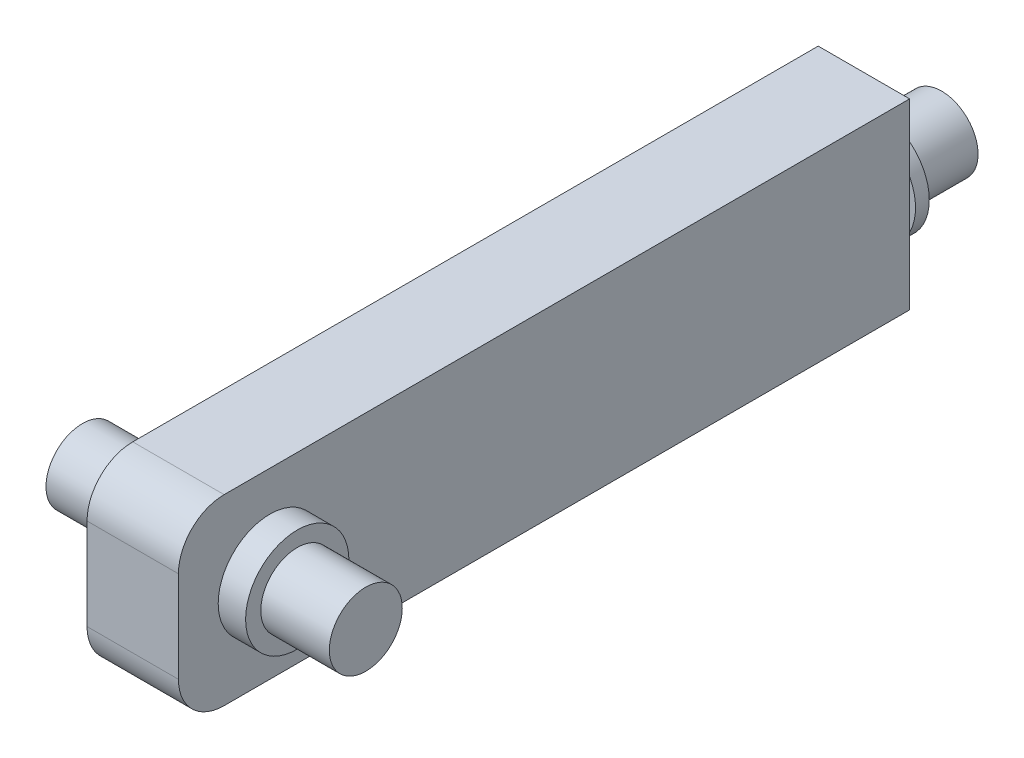
from build123d import *

# Parameters (mm, degrees)
SKETCH1_W           = 10
SKETCH1_H           = 80
BOSS_EXTRUDE1_DEPTH = 20
FILLET1_R           = 5
SKETCH3_R           = 3.99
BOSS_EXTRUDE2_DEPTH = 8.5
SKETCH4_R           = 5.65
BOSS_EXTRUDE3_DEPTH = 1.5
SKETCH2_R           = 5.65
BOSS_EXTRUDE4_DEPTH = 3
SKETCH6_R           = 3.99
BOSS_EXTRUDE5_DEPTH = 7.5
BOSS_EXTRUDE6_START = 3
SKETCH7_R           = 5.65
BOSS_EXTRUDE6_DEPTH = 3
BOSS_EXTRUDE7_START = 7.5
SKETCH9_R           = 3.99
BOSS_EXTRUDE7_DEPTH = 7.5


with BuildPart() as part:
    # Sketch1 → Boss-Extrude1 (new body)
    with BuildSketch(Plane(origin=(0, 0, 0), x_dir=(1, 0, 0), z_dir=(0, 1, 0))):
        with Locations((5, 40)):
            Rectangle(SKETCH1_W, SKETCH1_H)
    extrude(amount=BOSS_EXTRUDE1_DEPTH)

    # Fillet1
    fillet1_edges = [part.edges().sort_by_distance(p)[0] for p in [
        (5, 0, 0),
        (5, 20, 0),
    ]]
    fillet(fillet1_edges, radius=FILLET1_R)

    # Sketch3 → Boss-Extrude2 (add)
    with BuildSketch(Plane(origin=(0, 0, -80), x_dir=(-1, 0, 0), z_dir=(0, 0, -1))):
        with Locations(Location((-5, 10, 0), (0, 0, 180))):
            Circle(SKETCH3_R)
    extrude(amount=BOSS_EXTRUDE2_DEPTH)

    # Sketch4 → Boss-Extrude3 (add)
    with BuildSketch(Plane(origin=(0, 0, -80), x_dir=(-1, 0, 0), z_dir=(0, 0, -1))):
        with Locations(Location((-5, 10, 0), (0, 0, 207.753923356))):
            Circle(SKETCH4_R)
    extrude(amount=BOSS_EXTRUDE3_DEPTH)

    # Sketch2 → Boss-Extrude4 (add)
    with BuildSketch(Plane(origin=(10, 0, 0), x_dir=(0, 0, -1), z_dir=(1, 0, 0))):
        with Locations(Location((10, 10, 0), (0, 0, 180))):
            Circle(SKETCH2_R)
    extrude(amount=BOSS_EXTRUDE4_DEPTH)

    # Sketch6 → Boss-Extrude5 (add)
    with BuildSketch(Plane(origin=(13, 0, 0), x_dir=(0, 0, -1), z_dir=(1, 0, 0))):
        with Locations((10, 10)):
            Circle(SKETCH6_R)
    extrude(amount=BOSS_EXTRUDE5_DEPTH)

    # Sketch7 → Boss-Extrude6 (add)
    with BuildSketch(Plane.ZY.offset(BOSS_EXTRUDE6_START)):
        with Locations((-10, 10)):
            Circle(SKETCH7_R)
    extrude(amount=-BOSS_EXTRUDE6_DEPTH)

    # Sketch9 → Boss-Extrude7 (add)
    with BuildSketch(Plane.ZY.offset(3).offset(BOSS_EXTRUDE7_START)):
        with Locations(Location((-10, 10, 0), (0, 0, 180))):
            Circle(SKETCH9_R)
    extrude(amount=-BOSS_EXTRUDE7_DEPTH)


solid = part.part
